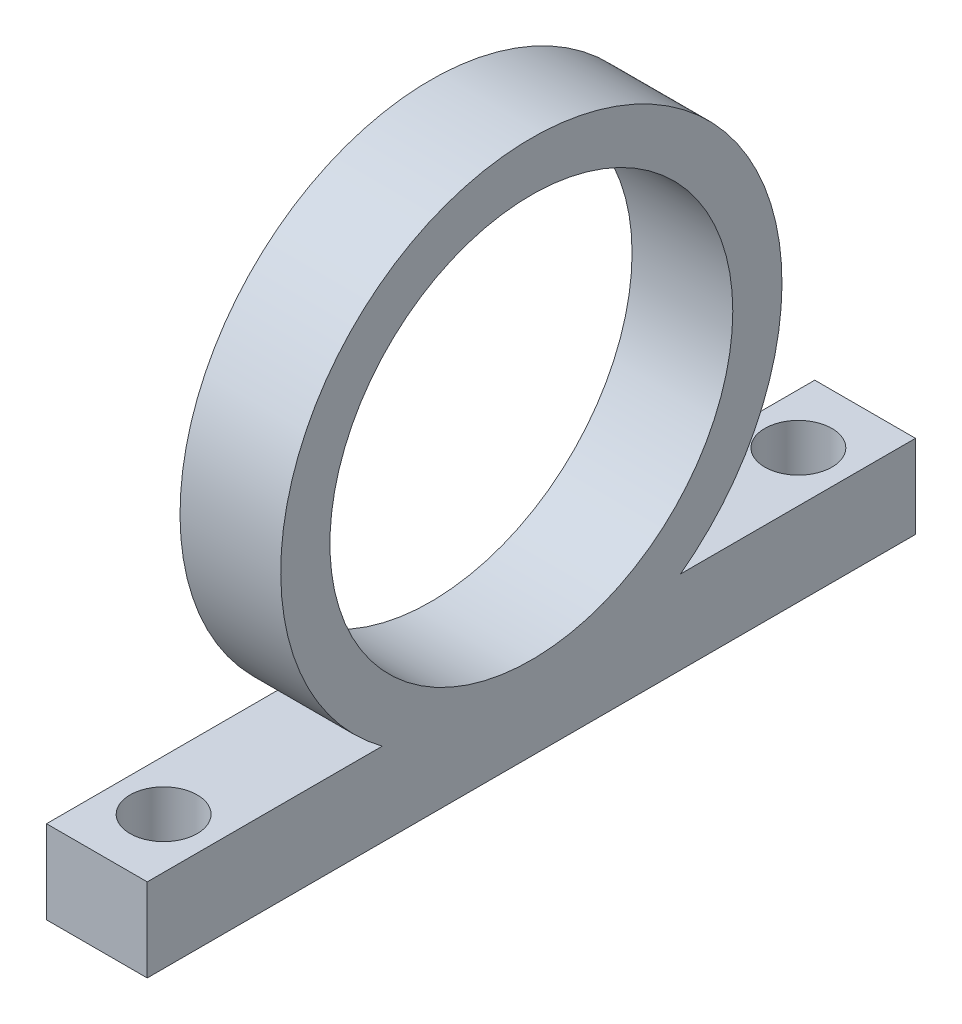
from build123d import *

# Parameters (mm, degrees)
SKETCH1_R           = 60
BOSS_EXTRUDE1_DEPTH = 30
SKETCH2_R           = 10
CUT_EXTRUDE1_DEPTH  = 180.223980285


with BuildPart() as part:
    # Sketch1 → Boss-Extrude1 (new body)
    with BuildSketch(Plane(origin=(0, 0, 0), x_dir=(0, 0, -1), z_dir=(1, 0, 0))):
        with BuildLine():
            Line((114.414215067, -60), (44.414215067, -60))
            ThreePointArc((44.414215067, -60), (0, 74.65), (-44.414215067, -60))
            Line((-44.414215067, -60), (-114.414215067, -60))
            Line((-114.414215067, -60), (-114.414215067, -84.8))
            Line((-114.414215067, -84.8), (114.414215067, -84.8))
            Line((114.414215067, -84.8), (114.414215067, -60))
        make_face()
        Circle(SKETCH1_R, mode=Mode.SUBTRACT)
    extrude(amount=BOSS_EXTRUDE1_DEPTH)

    # Sketch2 → Cut-Extrude1 (cut, through all)
    with BuildSketch(Plane(origin=(0, -60, 0), x_dir=(1, 0, 0), z_dir=(0, 1, 0))):
        with Locations(Location((15, -94.532107533, 0), (0, 0, 270))):
            Circle(SKETCH2_R)
        with Locations(Location((15, 94.532107533, 0), (0, 0, 270))):
            Circle(SKETCH2_R)
    extrude(amount=-CUT_EXTRUDE1_DEPTH, mode=Mode.SUBTRACT)


solid = part.part
